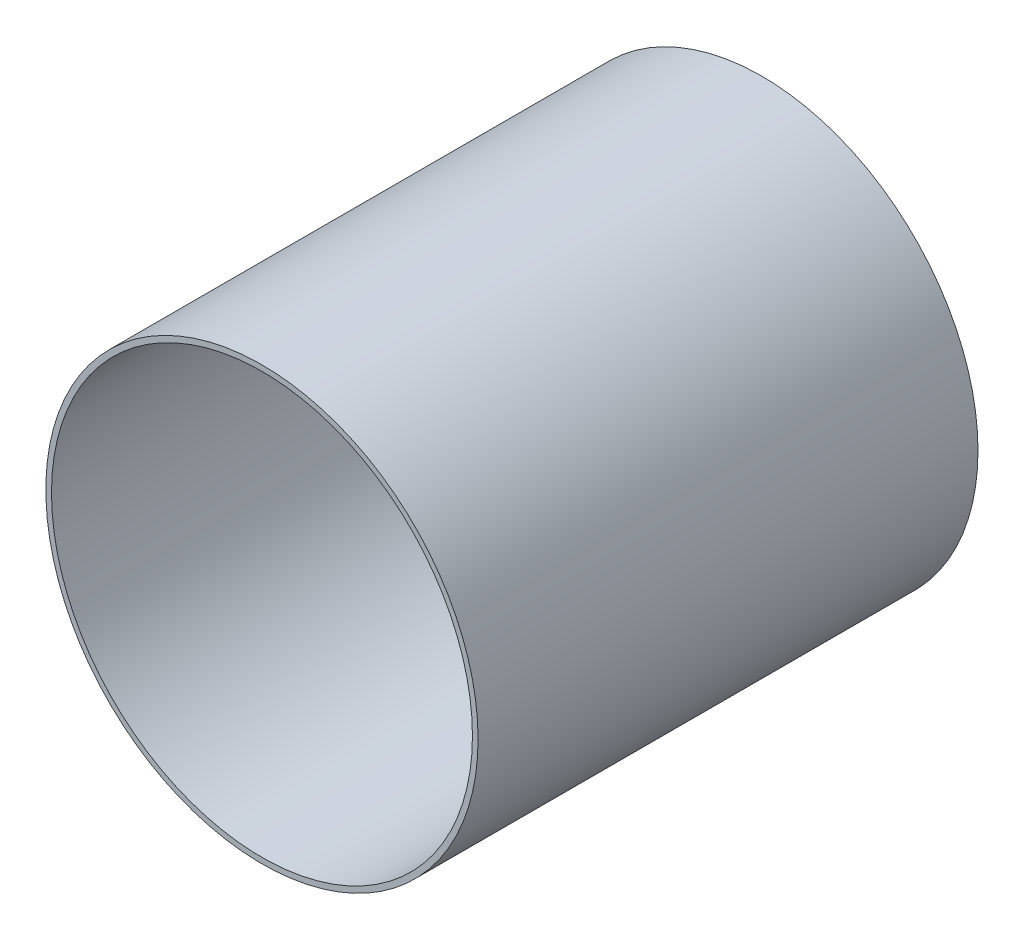
from build123d import *

# Parameters (mm, degrees)
SKETCH1_R           = 76.65
SKETCH1_R_2         = 74.65
BOSS_EXTRUDE1_DEPTH = 177.3


with BuildPart() as part:
    # Sketch1 → Boss-Extrude1 (new body)
    with BuildSketch(Plane.XY):
        Circle(SKETCH1_R)
        Circle(SKETCH1_R_2, mode=Mode.SUBTRACT)
    extrude(amount=BOSS_EXTRUDE1_DEPTH)


solid = part.part
